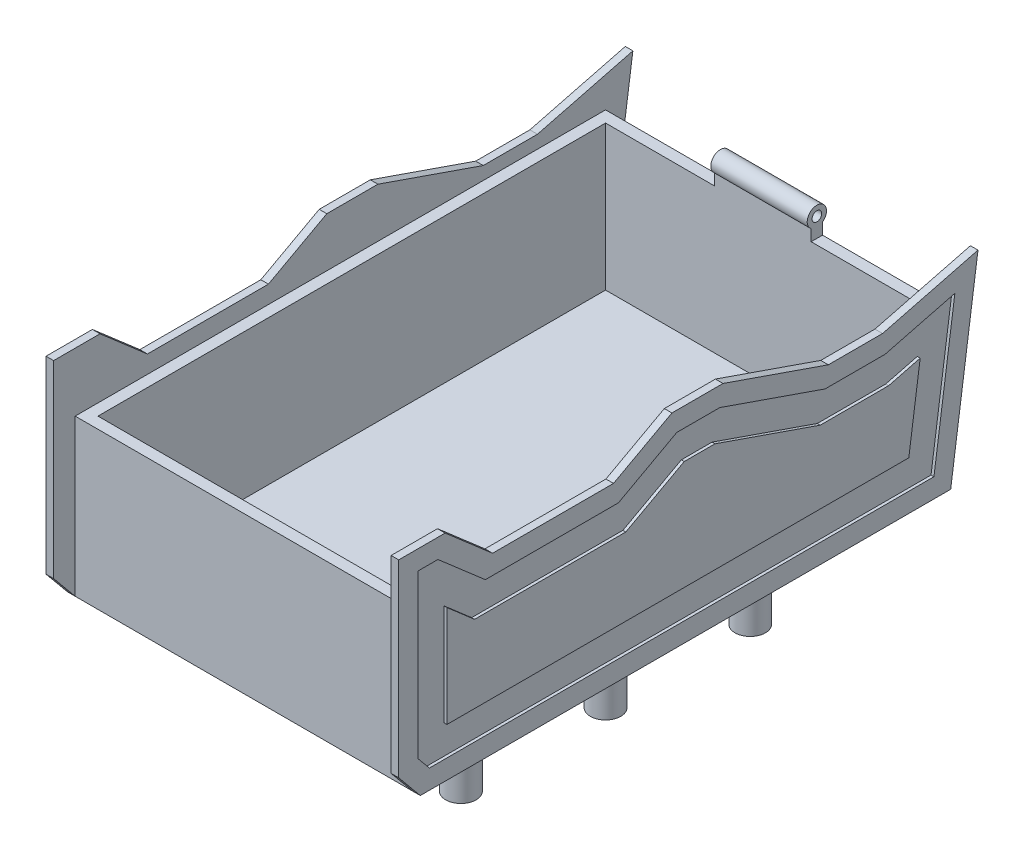
from build123d import *

# Parameters (mm, degrees)
SKETCH2_W           = 88.9
SKETCH2_H           = 139.7
BOSS_EXTRUDE1_DEPTH = 3
SKETCH3_R           = 4
BOSS_EXTRUDE2_DEPTH = 25.4
SKETCH4_W           = 88.9
SKETCH4_H           = 139.7
SKETCH4_W_2         = 82.9
SKETCH4_H_2         = 133.7
BOSS_EXTRUDE3_DEPTH = 38.1
BOSS_EXTRUDE4_DEPTH = 2
SKETCH6_R           = 1.27
BOSS_EXTRUDE5_DEPTH = 12.7
CUT_EXTRUDE1_DEPTH  = 0.762
CUT_EXTRUDE6_DEPTH  = 0.762


with BuildPart() as part:
    # Sketch2 → Boss-Extrude1 (new body)
    with BuildSketch(Plane(origin=(0, 0, 0), x_dir=(1, 0, 0), z_dir=(0, 1, 0))):
        Rectangle(SKETCH2_W, SKETCH2_H)
    extrude(amount=BOSS_EXTRUDE1_DEPTH)

    # Sketch3 → Boss-Extrude2 (add)
    with BuildSketch(Plane.XZ):
        with Locations(Location((-25.4, 0, 0), (0, 0, 90))):
            Circle(SKETCH3_R)
        with Locations(Location((-25.4, 38.1, 0), (0, 0, 90))):
            Circle(SKETCH3_R)
        with Locations(Location((-25.4, -38.1, 0), (0, 0, 90))):
            Circle(SKETCH3_R)
        with Locations(Location((25.4, -38.1, 0), (0, 0, 90))):
            Circle(SKETCH3_R)
        with Locations(Location((25.4, 38.1, 0), (0, 0, 90))):
            Circle(SKETCH3_R)
        with Locations(Location((25.4, 0, 0), (0, 0, 90))):
            Circle(SKETCH3_R)
    extrude(amount=BOSS_EXTRUDE2_DEPTH)

    # Sketch4 → Boss-Extrude3 (add)
    with BuildSketch(Plane(origin=(0, 3, 0), x_dir=(1, 0, 0), z_dir=(0, 1, 0))):
        Rectangle(SKETCH4_W, SKETCH4_H)
        Rectangle(SKETCH4_W_2, SKETCH4_H_2, mode=Mode.SUBTRACT)
    extrude(amount=BOSS_EXTRUDE3_DEPTH)

    # Sketch5 → Boss-Extrude4 (add)
    with BuildSketch(Plane.ZY.offset(44.45)):
        Polygon((-69.85, 0), (-77.043871534, 50.972594762), (-51.91191344, 44.517938858), (-37.629270589, 44.517938858), (-9.887983512, 54.131256162), (3.570660713, 54.131256162), (18.951968399, 45.753936798), (50.813248605, 45.753936798), (63.3105611, 56.60325204), (75.533207386, 56.60325204), (75.533207386, 6.88866827), (69.85, 0), align=None)
    boss_extrude4 = extrude(amount=BOSS_EXTRUDE4_DEPTH)

    # Mirror1: Boss-Extrude4 across plane
    add(boss_extrude4.mirror(Plane(origin=(0, 0, 0), x_dir=(0, 0, 1), z_dir=(1, 0, 0))))

    # Sketch6 → Boss-Extrude5 (add, symmetric)
    with BuildSketch(Plane(origin=(0, 0, 0), x_dir=(0, 0, -1), z_dir=(1, 0, 0))):
        with BuildLine():
            Line((69.85, 41.1), (69.85, 44.1))
            ThreePointArc((69.85, 44.1), (68.35, 48.689780476), (66.85, 44.1))
            Line((66.85, 44.1), (66.85, 41.1))
            Line((66.85, 41.1), (69.85, 41.1))
        make_face()
        with Locations((68.35, 46.149780476)):
            Circle(SKETCH6_R, mode=Mode.SUBTRACT)
    extrude(amount=BOSS_EXTRUDE5_DEPTH, both=True)

    # Sketch8 → Cut-Extrude1 (cut)
    with BuildSketch(Plane(origin=(46.45, 0, 0), x_dir=(0, 0, -1), z_dir=(1, 0, 0))):
        Polygon((-67.455357815, 5.08), (65.436608301, 5.08), (70.952515373, 44.163280067), (52.553846412, 39.437938858), (36.774020754, 39.437938858), (9.032733678, 49.051256162), (-2.276983823, 49.051256162), (-17.658291509, 40.673936798), (-52.710677553, 40.673936798), (-65.207990048, 51.52325204), (-70.453207386, 51.52325204), (-70.453207386, 8.71372121), align=None)
        Polygon((-62.833207386, 12.7), (58.816520753, 12.7), (61.815481132, 33.949308024), (53.516745871, 31.817938858), (35.491146002, 31.817938858), (7.749858926, 41.431256162), (-0.336468488, 41.431256162), (-15.717776174, 33.053936798), (-55.556820974, 33.053936798), (-62.833207386, 39.370799727), align=None, mode=Mode.SUBTRACT)
    cut_extrude1 = extrude(amount=-CUT_EXTRUDE1_DEPTH, mode=Mode.SUBTRACT)

    # Mirror2: Cut-Extrude1 across plane
    add(cut_extrude1.mirror(Plane(origin=(0, 0, 0), x_dir=(0, 0, 1), z_dir=(1, 0, 0))), mode=Mode.SUBTRACT)

    # Sketch9 → Cut-Extrude6 (cut)
    with BuildSketch(Plane(origin=(0, 0, -69.85), x_dir=(-1, 0, 0), z_dir=(0, 0, -1))):
        with BuildLine():
            add(Edge.make_bspline(
                [(0, 2.232338579), (-3.191709729, 2.469022224), (-10.576818068, 3.01667051), (-19.626296774, 8.234734007), (-29.623964586, 1.483879995), (-40.159154339, 15.556067791), (-37.24863112, 4.012387296), (-44.245285678, 41.608866434), (-29.193824408, 38.042179171), (-20.009016941, 33.424397646), (-15.335608076, 29.1637284)],
                knots=[0, 0, 0, 0, 0.123775466, 0.286396729, 0.321356771, 0.473375892, 0.634369321, 0.669519432, 0.824876998, 1, 1, 1, 1], degree=3))
            Line((-15.335608076, 29.1637284), (-6.180896532, 39.205275306))
            Line((-6.180896532, 39.205275306), (-3.338363663, 32.108568953))
            Line((-3.338363663, 32.108568953), (-0.779698225, 29.775876168))
            Line((-0.779698225, 29.775876168), (-4.759630097, 20.191876056))
            Line((-4.759630097, 20.191876056), (-12.650845852, 13.932444189))
            Line((-12.650845852, 13.932444189), (-2.059030944, 11.741643035))
            Line((-2.059030944, 11.741643035), (0, 10.886592661))
            Line((0, 10.886592661), (2.059030944, 11.741643035))
            Line((2.059030944, 11.741643035), (12.650845852, 13.932444189))
            Line((12.650845852, 13.932444189), (4.759630097, 20.191876056))
            Line((4.759630097, 20.191876056), (0.779698225, 29.775876168))
            Line((0.779698225, 29.775876168), (3.338363663, 32.108568953))
            Line((3.338363663, 32.108568953), (6.180896532, 39.205275306))
            Line((6.180896532, 39.205275306), (15.335608076, 29.1637284))
            add(Edge.make_bspline(
                [(0, 2.232338579), (3.191709729, 2.469022224), (10.576818068, 3.01667051), (19.626296774, 8.234734007), (29.623964586, 1.483879995), (40.159154339, 15.556067791), (37.24863112, 4.012387296), (44.245285678, 41.608866434), (29.193824408, 38.042179171), (20.009016941, 33.424397646), (15.335608076, 29.1637284)],
                knots=[0, 0, 0, 0, 0.123775466, 0.286396729, 0.321356771, 0.473375892, 0.634369321, 0.669519432, 0.824876998, 1, 1, 1, 1], degree=3))
        make_face()
    extrude(amount=-CUT_EXTRUDE6_DEPTH, mode=Mode.SUBTRACT)


solid = part.part
